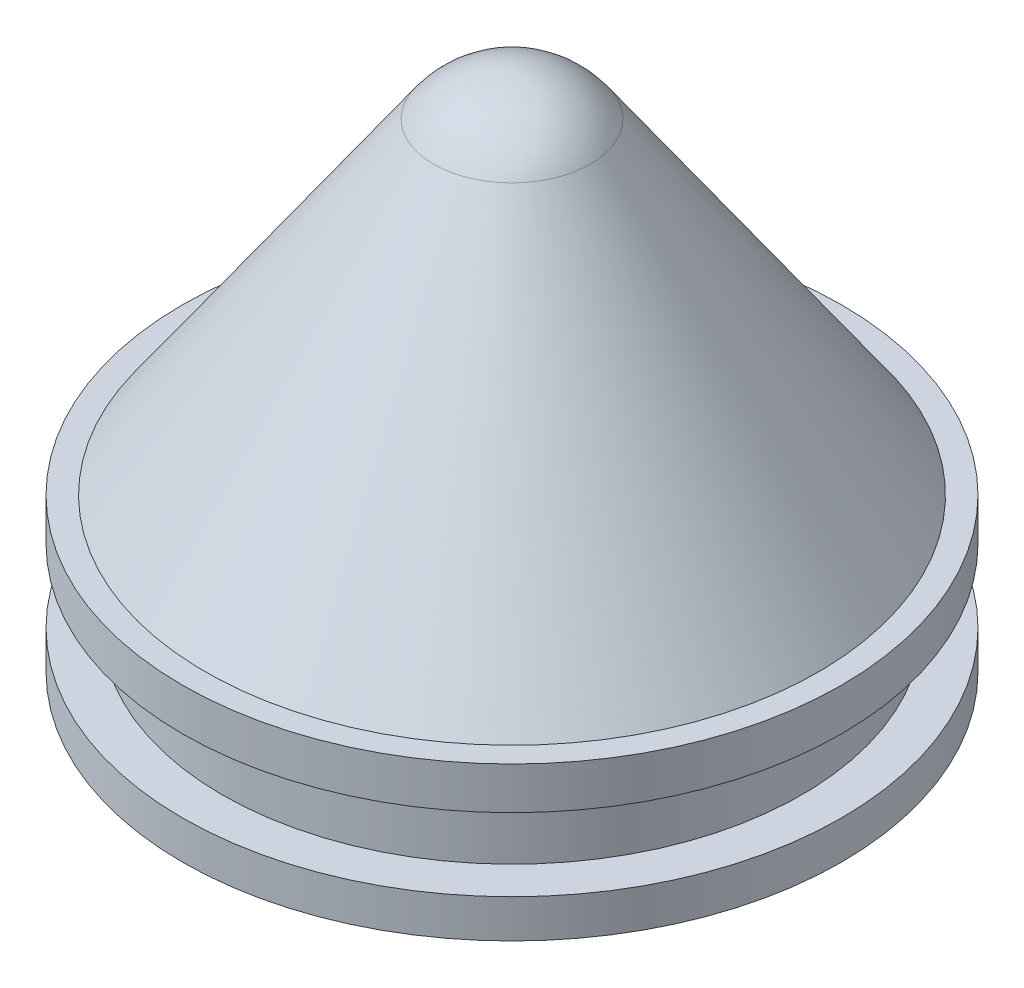
from build123d import *

# Parameters (mm, degrees)
SKETCH1_R           = 10.922
BOSS_EXTRUDE1_DEPTH = 5.08
SKETCH4_W           = 2.413
SKETCH4_H           = 2.413


with BuildPart() as part:
    # Sketch1 → Boss-Extrude1 (new body)
    with BuildSketch(Plane(origin=(0, 0, 0), x_dir=(1, 0, 0), z_dir=(0, 1, 0))):
        with Locations(Location((0, 0, 0), (0, 0, 270))):
            Circle(SKETCH1_R)
    extrude(amount=BOSS_EXTRUDE1_DEPTH)

    # Sketch4 → Cut-Revolve1 (revolve, cut)
    with BuildSketch(Plane.XY, mode=Mode.PRIVATE) as cut_revolve1_sk:
        with Locations((10.8077, 2.4765)):
            Rectangle(SKETCH4_W, SKETCH4_H)
    revolve(cut_revolve1_sk.sketch.rotate(Axis((0, 0, 0), (0, 1, 0)), 90), axis=Axis((0, 0, 0), (0, 1, 0)), mode=Mode.SUBTRACT)

    # Sketch5 → Revolve1 (revolve)
    with BuildSketch(Plane.XY, mode=Mode.PRIVATE) as revolve1_sk:
        with BuildLine():
            Line((10.16, 5.08), (2.600807741, 15.875645358))
            ThreePointArc((2.600807741, 15.875645358), (1.466051847, 16.870799568), (0, 17.229540172))
            Line((0, 17.229540172), (0, 5.08))
            Line((0, 5.08), (10.16, 5.08))
        make_face()
    revolve(revolve1_sk.sketch.rotate(Axis((0, 21.184130684, 0), (0, -1, 0)), 270), axis=Axis((0, 21.184130684, 0), (0, -1, 0)))


solid = part.part
